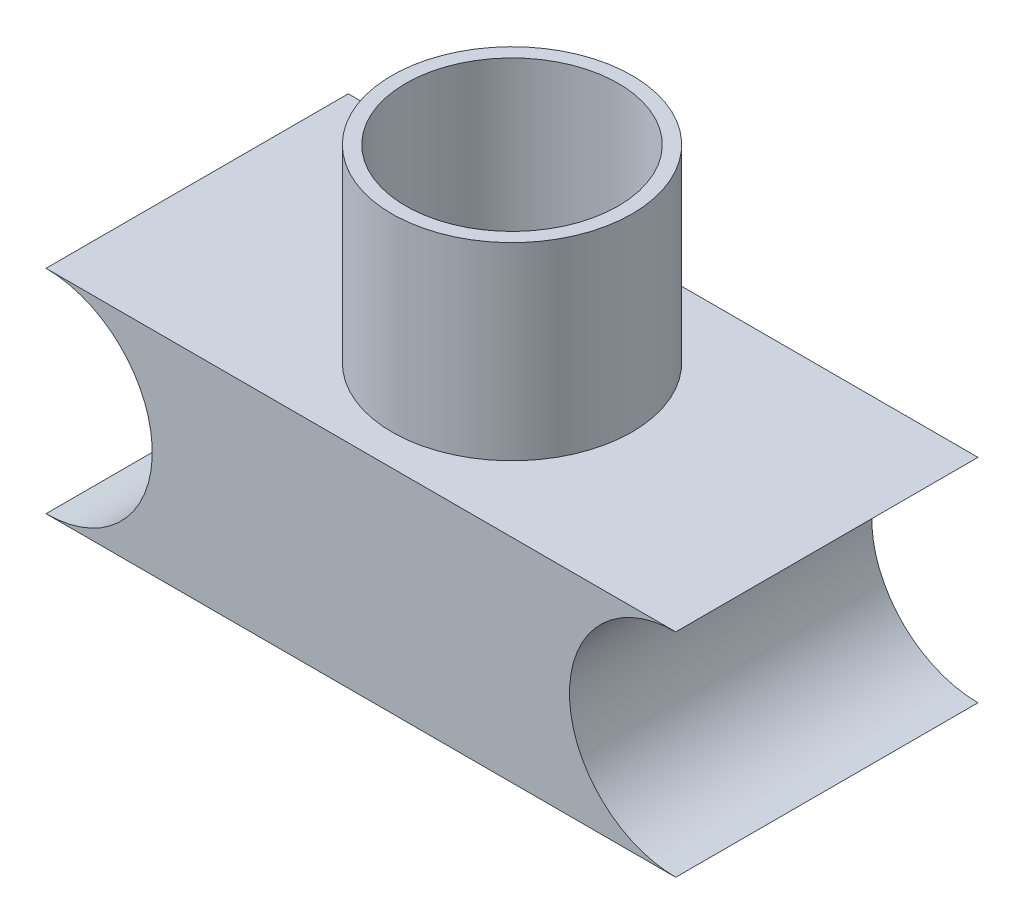
from build123d import *

# Parameters (mm, degrees)
BOSS_EXTRUDE2_DEPTH = 15.24
SKETCH3_R           = 12.099925
SKETCH3_R_2         = 10.715625
BOSS_EXTRUDE3_DEPTH = 19.05


with BuildPart() as part:
    # Sketch1 → Boss-Extrude2 (new, symmetric)
    with BuildSketch(Plane.XY):
        with BuildLine():
            Line((-31.75, 10.715625), (31.75, 10.715625))
            ThreePointArc((31.75, 10.715625), (21.034375, 0), (31.75, -10.715625))
            Line((31.75, -10.715625), (-31.75, -10.715625))
            ThreePointArc((-31.75, -10.715625), (-21.034375, 0), (-31.75, 10.715625))
        make_face()
    extrude(amount=BOSS_EXTRUDE2_DEPTH, both=True)

    # Sketch3 → Boss-Extrude3 (add)
    with BuildSketch(Plane(origin=(0, 10.715625, 0), x_dir=(1, 0, 0), z_dir=(0, 1, 0))):
        Circle(SKETCH3_R)
        Circle(SKETCH3_R_2, mode=Mode.SUBTRACT)
    extrude(amount=BOSS_EXTRUDE3_DEPTH)


solid = part.part
